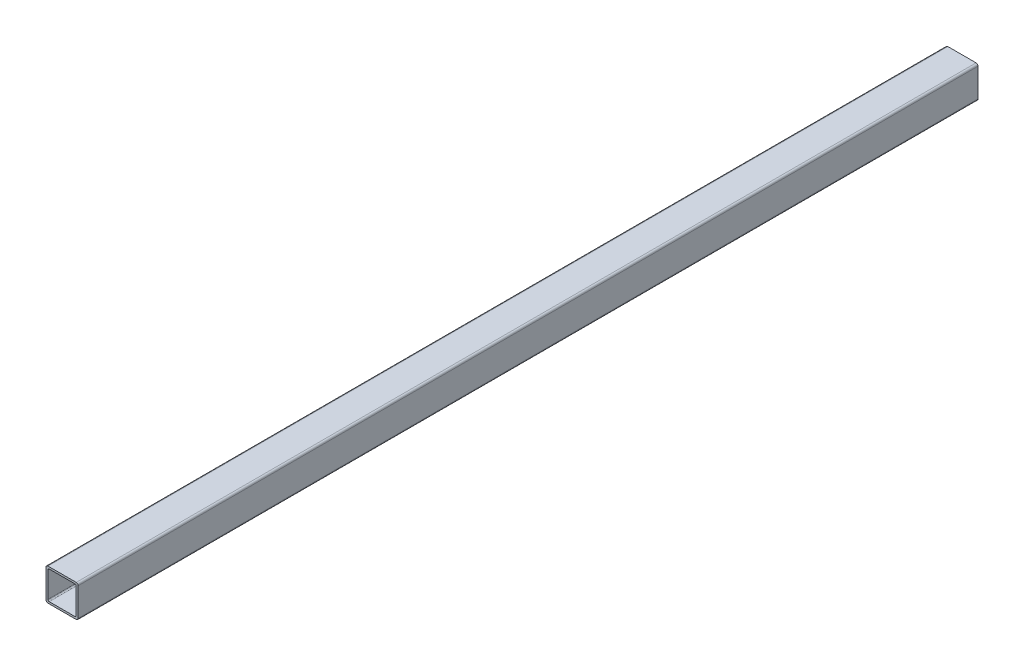
from build123d import *

# Parameters (mm, degrees)
EXTRUDE_1_DEPTH = 2800


with BuildPart() as part:
    # Эскиз2 → Бобышка-Вытянуть1 (new body)
    with BuildSketch(Plane.XY):
        with BuildLine():
            Line((6, 100), (94, 100))
            ThreePointArc((94, 100), (98.242640687, 98.242640687), (100, 94))
            Line((100, 94), (100, 6))
            ThreePointArc((100, 6), (98.242640687, 1.757359313), (94, 0))
            Line((94, 0), (6, 0))
            ThreePointArc((6, 0), (1.757359313, 1.757359313), (0, 6))
            Line((0, 6), (0, 94))
            ThreePointArc((0, 94), (1.757359313, 98.242640687), (6, 100))
        make_face()
        with BuildLine():
            Line((10, 94), (90, 94))
            ThreePointArc((90, 94), (92.828427125, 92.828427125), (94, 90))
            Line((94, 90), (94, 10))
            ThreePointArc((94, 10), (92.828427125, 7.171572875), (90, 6))
            Line((90, 6), (10, 6))
            ThreePointArc((10, 6), (7.171572875, 7.171572875), (6, 10))
            Line((6, 10), (6, 90))
            ThreePointArc((6, 90), (7.171572875, 92.828427125), (10, 94))
        make_face(mode=Mode.SUBTRACT)
    extrude(amount=EXTRUDE_1_DEPTH)


solid = part.part
